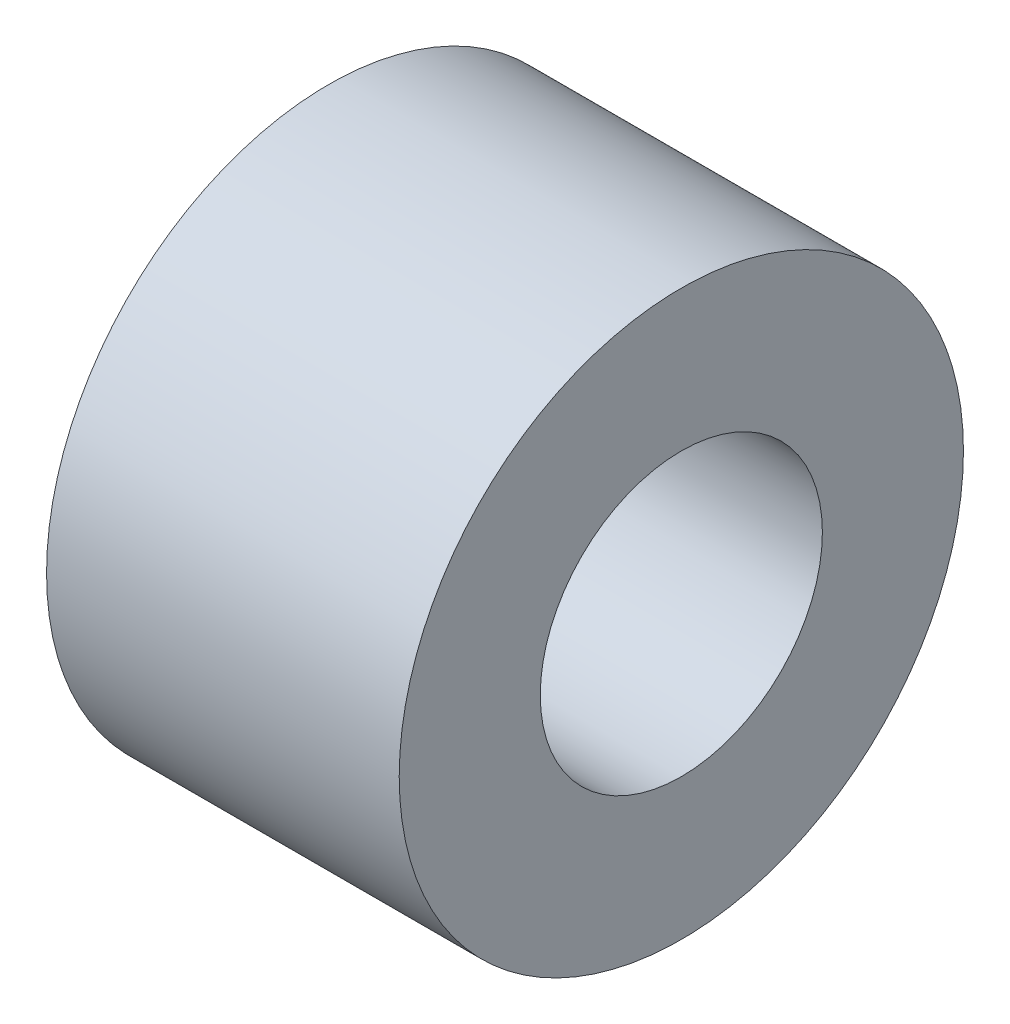
from build123d import *

# Parameters (mm, degrees)
SKETCH1_R           = 203.2
SKETCH1_R_2         = 101.6
BOSS_EXTRUDE1_DEPTH = 127


with BuildPart() as part:
    # Sketch1 → Boss-Extrude1 (new, symmetric)
    with BuildSketch(Plane(origin=(0, 0, 0), x_dir=(0, 0, -1), z_dir=(1, 0, 0))):
        Circle(SKETCH1_R)
        Circle(SKETCH1_R_2, mode=Mode.SUBTRACT)
    extrude(amount=BOSS_EXTRUDE1_DEPTH, both=True)


solid = part.part
